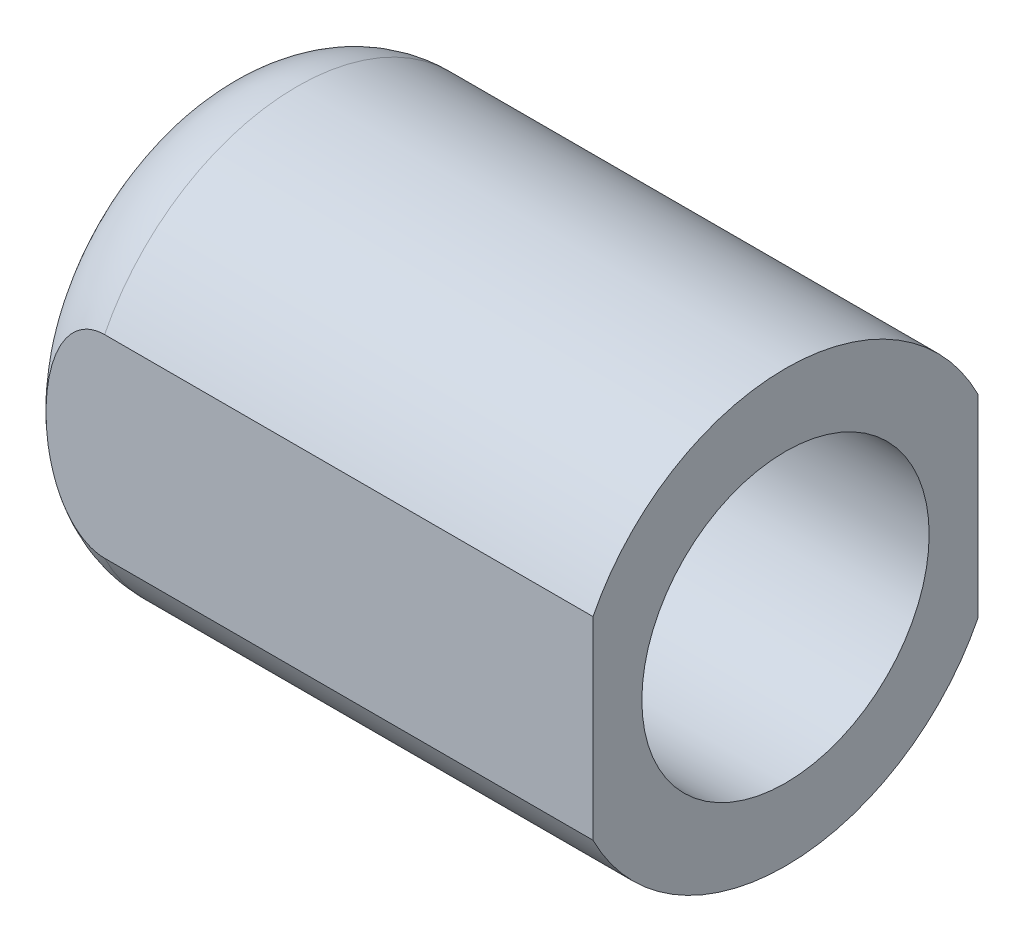
from build123d import *

# Parameters (mm, degrees)
FILLET1_R          = 3
SKETCH2_W          = 17.193533638
SKETCH2_H          = 22.71470374
SKETCH2_W_2        = 13.4
SKETCH2_H_2        = 17.458798434
CUT_EXTRUDE1_DEPTH = 23.638462845
CUT_EXTRUDE3_DEPTH = 21.618923503


with BuildPart() as part:
    # Sketch1 → Revolve1 (revolve)
    with BuildSketch(Plane.XY, mode=Mode.PRIVATE) as revolve1_sk:
        Polygon((18, 7.5), (18, 5), (0, 5), (0, 0), (-2, 0), (-2, 7.5), align=None)
    revolve(revolve1_sk.sketch.rotate(Axis((-2, 0, 0), (1, 0, 0)), 90), axis=Axis((-2, 0, 0), (1, 0, 0)))

    # Fillet1
    fillet1_edges = [part.edges().sort_by_distance(p)[0] for p in [
        (-2, 0, -7.5),
    ]]
    fillet(fillet1_edges, radius=FILLET1_R)

    # Sketch2 → Cut-Extrude1 (cut, through all)
    with BuildSketch(Plane(origin=(18, 0, 0), x_dir=(0, 0, -1), z_dir=(1, 0, 0))):
        Rectangle(SKETCH2_W, SKETCH2_H)
        Rectangle(SKETCH2_W_2, SKETCH2_H_2, mode=Mode.SUBTRACT)
    extrude(amount=-CUT_EXTRUDE1_DEPTH, mode=Mode.SUBTRACT)

    # Sketch3 → Cut-Extrude3 (cut, through all)
    with BuildSketch(Plane(origin=(0, 0, 0), x_dir=(0, 0, -1), z_dir=(1, 0, 0))):
        with BuildLine():
            ThreePointArc((0.489588204, 0.16097561), (0, 1.65), (-0.489588204, 0.16097561))
            ThreePointArc((-0.489588204, 0.16097561), (-0.408276253, 0), (-0.489588204, -0.16097561))
            ThreePointArc((-0.489588204, -0.16097561), (0, -1.65), (0.489588204, -0.16097561))
            ThreePointArc((0.489588204, -0.16097561), (0.408276253, 0), (0.489588204, 0.16097561))
        make_face()
    extrude(amount=-CUT_EXTRUDE3_DEPTH, mode=Mode.SUBTRACT)


solid = part.part
